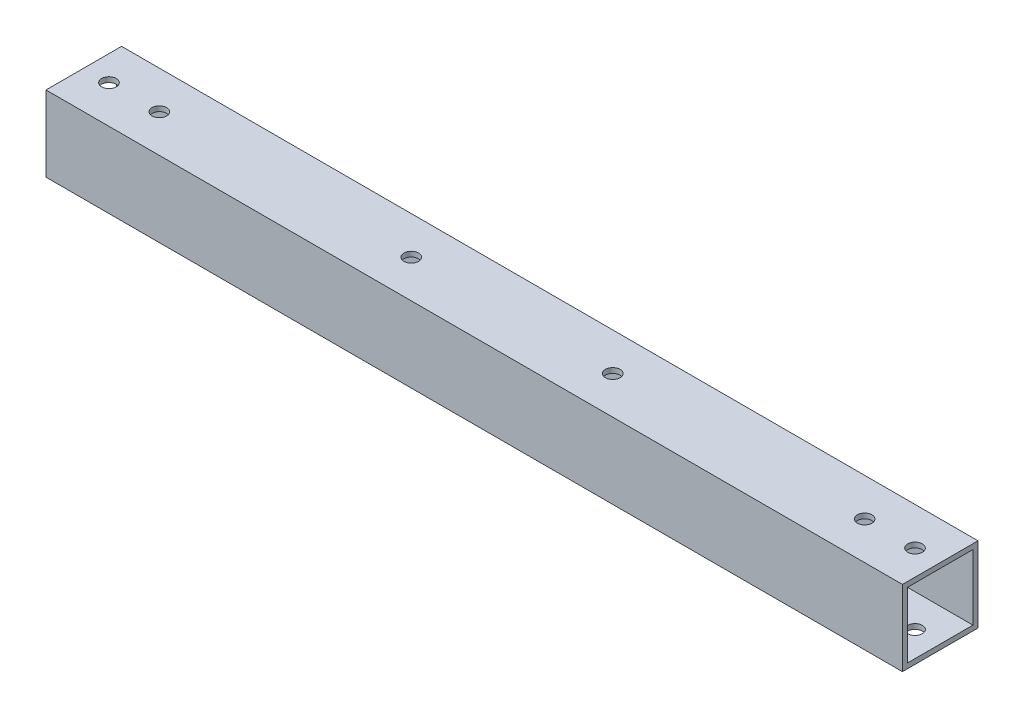
from build123d import *

# Parameters (mm, degrees)
SKETCH_11_W         = 15
SKETCH_11_H         = 15
SKETCH_11_W_2       = 13
SKETCH_11_H_2       = 13
F_15X15X1_1_DEPTH   = 170
SKETCH_13_R         = 1.45
CUT_EXTRUDE_2_DEPTH = 87.638617256
SKETCH_14_R         = 1.45
CUT_EXTRUDE_3_DEPTH = 87.638617256


with BuildPart() as part:
    # 草图11 → 铝管 15X15X1(1) (new body)
    with BuildSketch(Plane(origin=(-85, 0, 0), x_dir=(0, 0, -1), z_dir=(1, 0, 0))):
        Rectangle(SKETCH_11_W, SKETCH_11_H)
        Rectangle(SKETCH_11_W_2, SKETCH_11_H_2, mode=Mode.SUBTRACT)
    extrude(amount=F_15X15X1_1_DEPTH)

    # 草图13 → 切除-拉伸2 (cut, through all)
    with BuildSketch(Plane(origin=(0, 7.5, 0), x_dir=(1, 0, 0), z_dir=(0, 1, 0))):
        with Locations(Location((-80, 0, 0), (0, 0, 270))):
            Circle(SKETCH_13_R)
        with Locations(Location((-70, 0, 0), (0, 0, 270))):
            Circle(SKETCH_13_R)
        with Locations(Location((70, 0, 0), (0, 0, 90))):
            Circle(SKETCH_13_R)
        with Locations(Location((80, 0, 0), (0, 0, 90))):
            Circle(SKETCH_13_R)
    extrude(amount=-CUT_EXTRUDE_2_DEPTH, mode=Mode.SUBTRACT)

    # 草图14 → 切除-拉伸3 (cut, through all)
    with BuildSketch(Plane(origin=(0, 7.5, 0), x_dir=(1, 0, 0), z_dir=(0, 1, 0))):
        with Locations(Location((-20, 0, 0), (0, 0, 270))):
            Circle(SKETCH_14_R)
        with Locations(Location((20, 0, 0), (0, 0, 270))):
            Circle(SKETCH_14_R)
    extrude(amount=-CUT_EXTRUDE_3_DEPTH, mode=Mode.SUBTRACT)


solid = part.part
